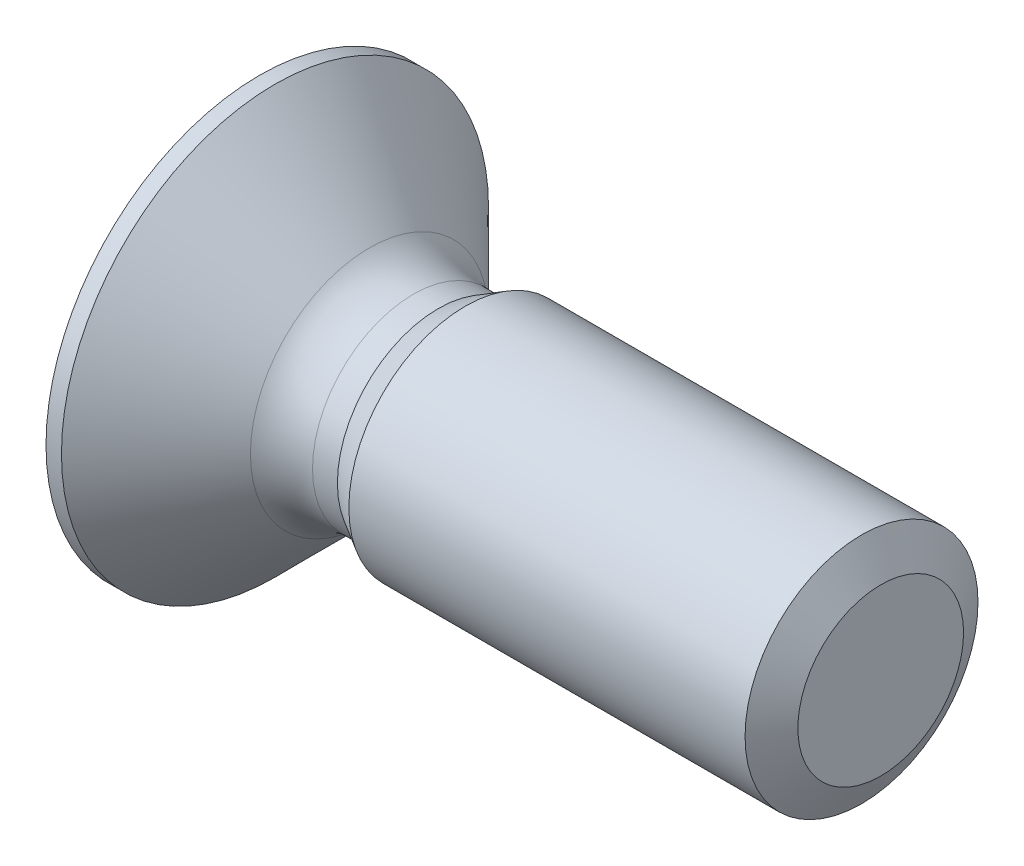
from build123d import *

# Parameters (mm, degrees)
PATTERN_CIRCULAR_1_COUNT = 2
PATTERN_CIRCULAR_1_ANGLE = 90


with BuildPart() as part:
    # 草图1 → Revolve 694 (revolve)
    with BuildSketch(Plane.XY, mode=Mode.PRIVATE) as revolve_694_sk:
        with BuildLine():
            Line((0, 0), (0, 2.75))
            Line((0, 2.75), (0.199, 2.75))
            Line((0.199, 2.75), (1.415685425, 1.533314575))
            ThreePointArc((1.415685425, 1.533314575), (1.675224104, 1.359896374), (1.98137085, 1.299))
            Line((1.98137085, 1.299), (2.301857788, 1.299))
            Line((2.301857788, 1.299), (2.65, 1.5))
            Line((2.65, 1.5), (8, 1.5))
            Line((8, 1.5), (8, 0))
            Line((8, 0), (0, 0))
        make_face()
    revolve(revolve_694_sk.sketch.rotate(Axis((0, 0, 0), (1, 0, 0)), 90), axis=Axis((0, 0, 0), (1, 0, 0)))

    # 草图2 → 切除-旋转1 (revolve, cut)
    with BuildSketch(Plane.XY, mode=Mode.PRIVATE) as cut_revolve_1_sk:
        Polygon((7.752708003, 1.5), (8.252708003, 1.5), (8, 1.067), align=None)
    revolve(cut_revolve_1_sk.sketch.rotate(Axis((0, 0, 0), (-1, 0, 0)), 270), axis=Axis((0, 0, 0), (-1, 0, 0)), mode=Mode.SUBTRACT)

    # 草图3 → 切除-放样1 section 0
    with BuildSketch(Plane.ZY, mode=Mode.PRIVATE) as loft_1_s0:
        with BuildLine():
            Line((-1.6, 0.25), (1.6, 0.25))
            Line((1.6, 0.25), (1.6, -0.25))
            Line((1.6, -0.25), (-1.6, -0.25))
            Line((-1.6, -0.25), (-1.6, 0.25))
        make_face()
    loft_1 = loft([loft_1_s0.sketch, Vertex(2.1, 0, 0)], mode=Mode.SUBTRACT)

    # 阵列(圆周)1: 切除-放样1 ×2 about axis
    pattern_circular_1_axis = Axis((0, 0, 0), (1, 0, 0))
    for i in range(1, PATTERN_CIRCULAR_1_COUNT):
        add(loft_1.rotate(pattern_circular_1_axis, i * PATTERN_CIRCULAR_1_ANGLE / (PATTERN_CIRCULAR_1_COUNT - 1)), mode=Mode.SUBTRACT)


solid = part.part
